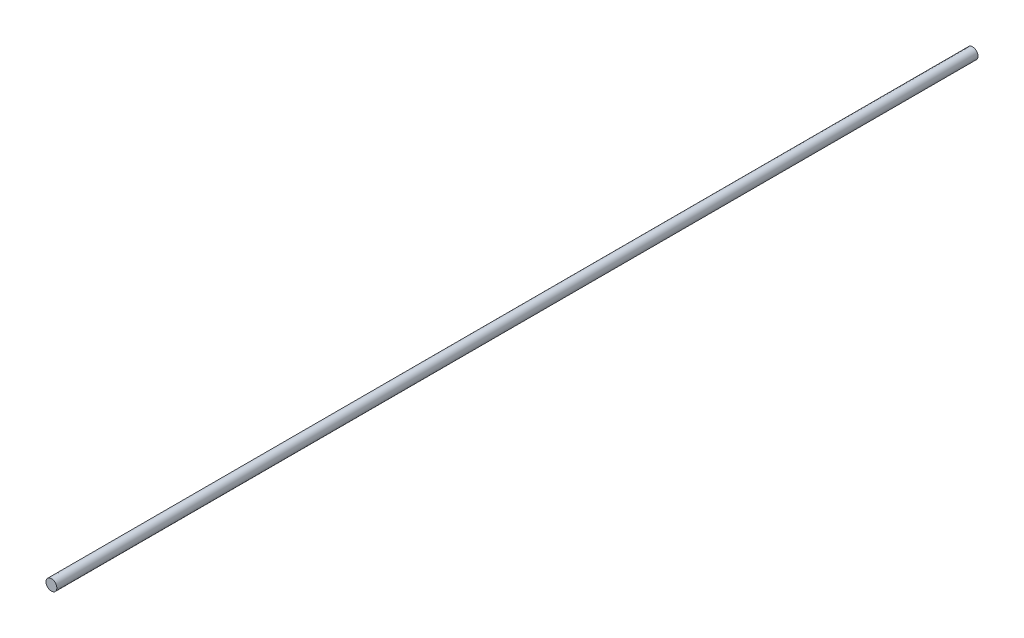
from build123d import *

# Parameters (mm, degrees)
SCHIZZO1_R                   = 1.5
ESTRUSIONE_ESTRUSIONE1_DEPTH = 255


with BuildPart() as part:
    # Schizzo1 → Estrusione-Estrusione1 (new body)
    with BuildSketch(Plane.XY):
        Circle(SCHIZZO1_R)
    extrude(amount=ESTRUSIONE_ESTRUSIONE1_DEPTH)


solid = part.part
